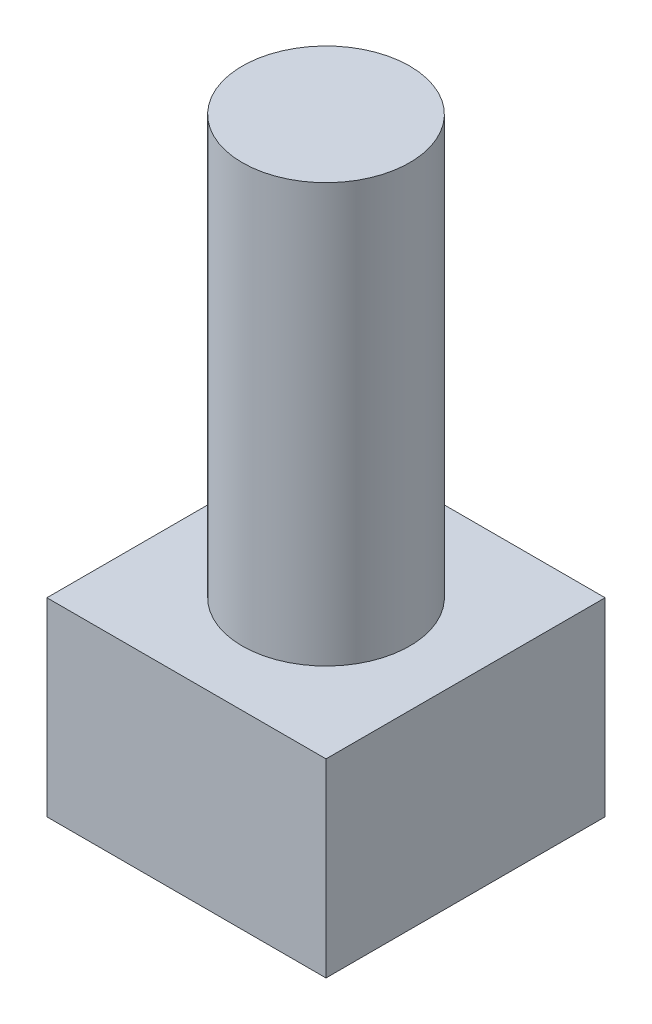
from build123d import *

# Parameters (mm, degrees)
SKETCH1_W           = 10
SKETCH1_H           = 10
BOSS_EXTRUDE1_DEPTH = 6.8
SKETCH2_R           = 3
BOSS_EXTRUDE2_DEPTH = 15


with BuildPart() as part:
    # Sketch1 → Boss-Extrude1 (new body)
    with BuildSketch(Plane(origin=(0, 0, 0), x_dir=(1, 0, 0), z_dir=(0, 1, 0))):
        Rectangle(SKETCH1_W, SKETCH1_H)
    extrude(amount=BOSS_EXTRUDE1_DEPTH)

    # Sketch2 → Boss-Extrude2 (add)
    with BuildSketch(Plane(origin=(0, 6.8, 0), x_dir=(1, 0, 0), z_dir=(0, 1, 0))):
        with Locations(Location((0, 0, 0), (0, 0, 270))):
            Circle(SKETCH2_R)
    extrude(amount=BOSS_EXTRUDE2_DEPTH)


solid = part.part
